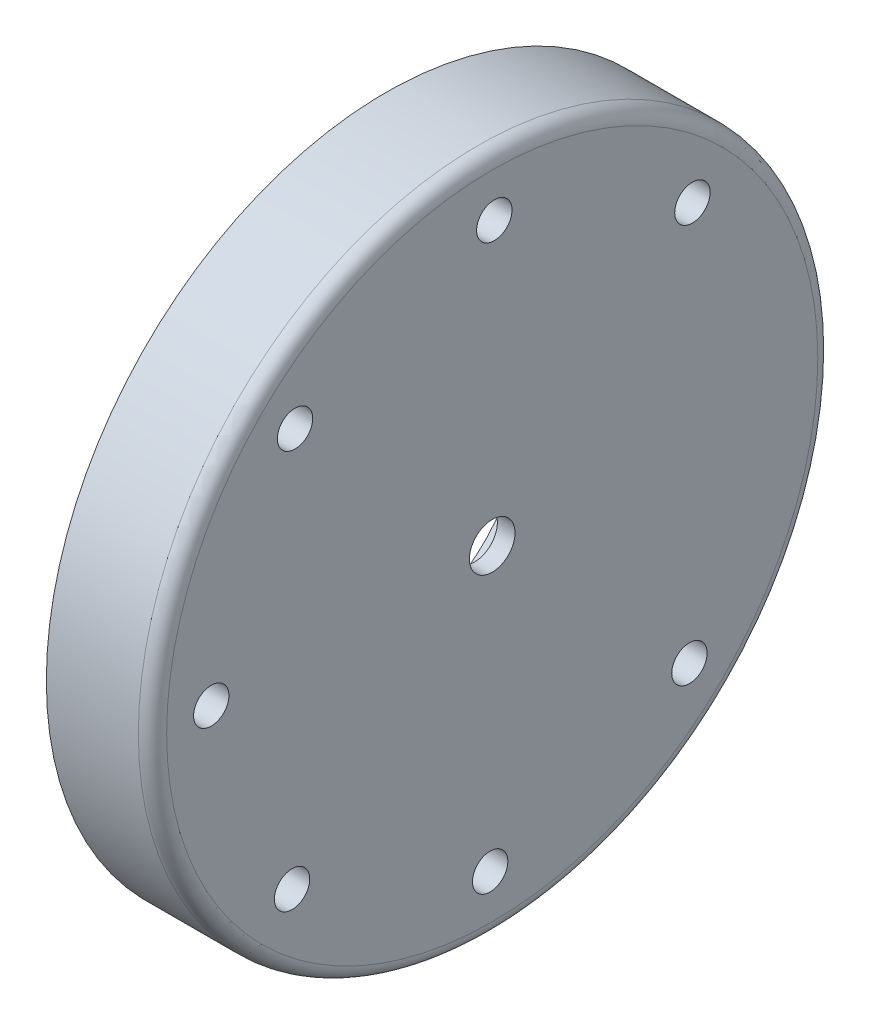
from build123d import *

# Parameters (mm, degrees)
SKETCH1_R           = 60.96
BOSS_EXTRUDE1_DEPTH = 19.05
FILLET1_R           = 2.54
SKETCH2_R           = 4
CUT_EXTRUDE1_DEPTH  = 6.35
SKETCH4_R           = 25.019
CUT_EXTRUDE3_DEPTH  = 89.290122324
SKETCH5_R           = 3.175
CUT_EXTRUDE4_DEPTH  = 89.290122324
CIRPATTERN2_COUNT   = 8
SKETCH6_R           = 25.019
SKETCH6_R_2         = 4.09575
BOSS_EXTRUDE2_DEPTH = 3.175


with BuildPart() as part:
    # Sketch1 → Boss-Extrude1 (new body)
    with BuildSketch(Plane(origin=(0, 0, 0), x_dir=(0, 0, -1), z_dir=(1, 0, 0))):
        with Locations(Location((0, 0, 0), (0, 0, 180))):
            Circle(SKETCH1_R)
    extrude(amount=BOSS_EXTRUDE1_DEPTH)

    # Fillet1
    fillet1_edges = [part.edges().sort_by_distance(p)[0] for p in [
        (19.05, 0, -60.96),
    ]]
    fillet(fillet1_edges, radius=FILLET1_R)

    # Sketch2 → Cut-Extrude1 (cut)
    with BuildSketch(Plane(origin=(19.05, 0, 0), x_dir=(0, 0, -1), z_dir=(1, 0, 0))):
        Circle(SKETCH2_R)
    extrude(amount=-CUT_EXTRUDE1_DEPTH, mode=Mode.SUBTRACT)

    # Sketch4 → Cut-Extrude3 (cut, through all)
    with BuildSketch(Plane(origin=(19.05, 0, 0), x_dir=(0, 0, -1), z_dir=(1, 0, 0))):
        Circle(SKETCH4_R)
    extrude(amount=-CUT_EXTRUDE3_DEPTH, mode=Mode.SUBTRACT)

    # Sketch5 → Cut-Extrude4 (cut, through all)
    with BuildSketch(Plane.ZY):
        with Locations((-35.91734849, 35.383889532)):
            Circle(SKETCH5_R)
    cut_extrude4 = extrude(amount=-CUT_EXTRUDE4_DEPTH, mode=Mode.SUBTRACT)

    # CirPattern2: Cut-Extrude4 ×8 about axis, 1 skipped
    cirpattern2_axis = Axis((0, 0, 0), (1, 0, 0))
    add([cut_extrude4.rotate(cirpattern2_axis, i * 360 / CIRPATTERN2_COUNT) for i in range(1, CIRPATTERN2_COUNT) if i not in (7,)], mode=Mode.SUBTRACT)

    # Sketch6 → Boss-Extrude2 (add)
    with BuildSketch(Plane(origin=(19.05, 0, 0), x_dir=(0, 0, -1), z_dir=(1, 0, 0))):
        Circle(SKETCH6_R)
        Circle(SKETCH6_R_2, mode=Mode.SUBTRACT)
    extrude(amount=-BOSS_EXTRUDE2_DEPTH)


solid = part.part
